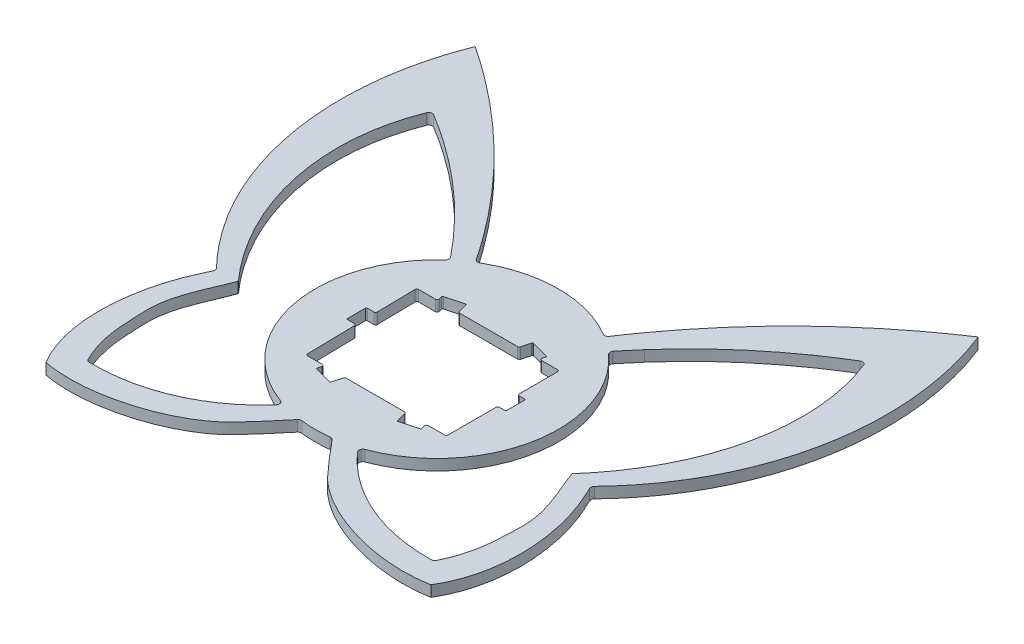
from build123d import *

# Parameters (mm, degrees)
SKETCH4_R                      = 33.5
CORE_EXTRUDE_DEPTH             = 3
LEFT_WING_EXTRUDE_DEPTH        = 3
SCREEN_CUTOUT_DEPTH            = 110.640899285
SCREEN_CUTOUT_DEPTH_BACK       = 110.640899285
LED_CUTOUT_DEPTH               = 110.640899285
LED_CUTOUT_DEPTH_BACK          = 110.640899285
WING_INTERIOR_CORNERS_FILLET_R = 1
FILLET4_R                      = 0.25
FILLET5_R                      = 0.5


with BuildPart() as part:
    # Sketch4 → Core Extrude (new body)
    with BuildSketch(Plane(origin=(0, 0, 0), x_dir=(1, 0, 0), z_dir=(0, 1, 0))):
        Circle(SKETCH4_R)
    extrude(amount=CORE_EXTRUDE_DEPTH)

    # Sketch4<3> → Left Wing Extrude (add)
    with BuildSketch(Plane(origin=(0, 0, 0), x_dir=(1, 0, 0), z_dir=(0, 1, 0))):
        with BuildLine():
            Line((-10.347153336, -31.861990174), (-10.574416, -32.223007))
            add(Edge.make_bspline(
                [(-47.69897, -48.554457), (-47.005895333, -48.581326851), (-45.954505916, -48.597017802), (-44.545738302, -48.571280153), (-43.473641766, -48.527252414), (-42.402918126, -48.458960819), (-41.334217255, -48.366466338), (-40.268122658, -48.249861876), (-39.205241478, -48.109233637), (-38.146172423, -47.944658617), (-37.091526152, -47.756231634), (-36.041906711, -47.544036079), (-34.997927299, -47.308153429), (-33.960162991, -47.048668526), (-32.929246015, -46.765677257), (-31.905878908, -46.459270641), (-30.725745207, -46.076084112), (-29.395210408, -45.600673033), (-27.922683477, -45.015601708), (-26.473441397, -44.380677994), (-25.048974531, -43.696973234), (-23.650861521, -42.965650167), (-22.28067676, -42.187857696), (-20.940013843, -41.364748569), (-19.630459024, -40.497485773), (-18.353628312, -39.58721855), (-17.111029342, -38.635148581), (-15.904502269, -37.642227441), (-14.73464199, -36.610334387), (-13.606749978, -35.537947333), (-12.508591949, -34.436177582), (-11.527977156, -33.309140575), (-10.821015407, -32.614741101), (-10.574416, -32.223007)],
                knots=[0, 0, 0, 0, 0.049532508, 0.075074575, 0.100617525, 0.126155751, 0.151690722, 0.177219143, 0.202739998, 0.228252933, 0.253755347, 0.279245241, 0.304722957, 0.330185505, 0.355633756, 0.381064261, 0.406469499, 0.444238982, 0.481947979, 0.519606395, 0.557213106, 0.594767196, 0.632267359, 0.669711427, 0.707095912, 0.744418594, 0.781676566, 0.818868141, 0.855992571, 0.893046307, 0.930030529, 0.966945445, 1, 1, 1, 1], degree=3))
            add(Edge.make_bspline(
                [(-45.941717, -8.763696), (-46.09328637, -9.192884506), (-46.42834086, -10.084854007), (-47.195678869, -11.975251266), (-48.038011165, -13.959460212), (-48.88402446, -16.027149922), (-49.507696109, -17.629829411), (-49.990853891, -18.977246269), (-50.342862874, -20.054403975), (-50.60427557, -20.91910442), (-50.852312475, -21.832776934), (-51.076720111, -22.786016913), (-51.25850344, -23.703242655), (-51.401130275, -24.590941827), (-51.508000336, -25.455502688), (-51.582538762, -26.303359745), (-51.628164435, -27.140920597), (-51.648325278, -27.974638429), (-51.6463858, -28.810813225), (-51.618990862, -29.950029305), (-51.5079164, -32.0996295), (-51.368709176, -34.256064819), (-51.253568615, -36.122660359), (-51.170401172, -36.987659949), (-51.065971706, -37.85012381), (-50.938187356, -38.709790324), (-50.78777952, -39.566142248), (-50.614740122, -40.418652335), (-50.419248729, -41.26677916), (-50.201448116, -42.109987501), (-49.961479038, -42.947751391), (-49.69949039, -43.779529588), (-49.415620595, -44.604804948), (-49.1100189, -45.423025068), (-48.782840447, -46.233685804), (-48.326357547, -47.284316489), (-47.956394456, -48.054396549), (-47.69897, -48.554457)],
                knots=[0, 0, 0, 0, 0.033014029, 0.069128858, 0.148008121, 0.189408993, 0.231211659, 0.272772284, 0.293241863, 0.313423973, 0.338306891, 0.361917513, 0.384460523, 0.406133677, 0.427134042, 0.447650525, 0.467873046, 0.487981154, 0.508148449, 0.528534245, 0.570652123, 0.664299038, 0.685324715, 0.706326456, 0.727335119, 0.748350099, 0.769374817, 0.790409684, 0.811455893, 0.83251492, 0.853587341, 0.874675049, 0.895778172, 0.916899167, 0.93803739, 0.959196012, 1, 1, 1, 1], degree=3))
            ThreePointArc((-45.941717, -8.763696), (-45.936967837, -8.705531313), (-45.961537, -8.652597))
            add(Edge.make_bspline(
                [(-59.721574, 58.433712), (-60.10521331, 57.521446141), (-60.648694561, 56.117181361), (-61.302933543, 54.205440713), (-61.762957001, 52.729756349), (-62.181955817, 51.24310242), (-62.559582347, 49.746475071), (-62.895464459, 48.241050802), (-63.2446943, 46.443308526), (-63.573812888, 44.349284385), (-63.843920225, 41.957125496), (-64.011789172, 39.557851646), (-64.079206803, 37.154376946), (-64.048019481, 34.749707714), (-63.920046805, 32.346890784), (-63.697110836, 29.948958573), (-63.381036983, 27.558934189), (-62.973651506, 25.179901505), (-62.4767372, 22.814733697), (-61.306565668, 18.114282248), (-59.705936705, 13.514753261), (-57.687269251, 9.020513919), (-56.153926642, 5.90922097), (-54.41307803, 2.815150853), (-52.506055145, -0.182345625), (-50.992041528, -2.383350968), (-48.863646775, -5.251642416), (-47.151700581, -7.316916945), (-45.961537, -8.652597)],
                knots=[0, 0, 0, 0, 0.041114028, 0.06253456, 0.083937306, 0.105324619, 0.126697311, 0.148056917, 0.16939852, 0.202773782, 0.236093287, 0.269384531, 0.302668039, 0.335958931, 0.369269967, 0.402610582, 0.435987717, 0.469405609, 0.50286597, 0.53636883, 0.670639328, 0.704295775, 0.741051276, 0.814714819, 0.851640474, 0.888628051, 0.925677779, 1, 1, 1, 1], degree=3))
            add(Edge.make_bspline(
                [(-26.322685, 30.845812), (-27.808193561, 32.533846676), (-30.101194094, 35.011732714), (-33.280566512, 38.200858525), (-35.728223071, 40.53733558), (-38.236083571, 42.815466939), (-40.679257439, 44.927032919), (-43.047215602, 46.880655758), (-45.330457493, 48.685014217), (-47.653476454, 50.44294926), (-50.01519951, 52.153685866), (-52.414546684, 53.816507436), (-55.628223758, 55.945849533), (-58.078632572, 57.463807312), (-59.721574, 58.433712)],
                knots=[0, 0, 0, 0, 0.155077445, 0.23276273, 0.310546518, 0.388428455, 0.466410335, 0.533236019, 0.600133862, 0.667102284, 0.734139577, 0.801245743, 0.86842077, 1, 1, 1, 1], degree=3))
            add(Edge.make_bspline(
                [(-22.070606, 25.765023), (-23.430544903, 27.505930683), (-24.87829729, 29.175573669), (-26.322685, 30.845812)],
                knots=[0, 0, 0, 0, 1, 1, 1, 1], degree=3))
            Line((-22.070606, 25.765023), (-21.808318715, 25.429259423))
            ThreePointArc((-21.808318715, 25.429259423), (-18.305734365, 24.898926731), (-17.767242212, 28.400265917))
            Line((-17.767242212, 28.400265917), (-18.062056, 28.803227))
            add(Edge.make_bspline(
                [(-18.062056, 28.803227), (-18.429711463, 29.305750457), (-19.106871234, 30.396056169), (-20.598244848, 32.527599994), (-21.732445935, 34.149165486), (-22.512901, 35.21333)],
                knots=[0, 0, 0, 0, 0.239345854, 0.492764217, 1, 1, 1, 1], degree=3))
            add(Edge.make_bspline(
                [(-22.512901, 35.21333), (-23.290107821, 36.281464755), (-24.474104923, 37.871090144), (-26.088286235, 39.964416697), (-27.635859882, 41.925960296), (-29.539869033, 44.263782762), (-31.824520323, 46.958210288), (-34.945454463, 50.494676889), (-38.172929781, 53.942234271), (-41.50216093, 57.295995314), (-44.051583312, 59.766281651), (-46.651008049, 62.189043303), (-50.183814542, 65.35624815), (-53.811391777, 68.423472816), (-57.528731284, 71.386741365), (-60.363232963, 73.558312111), (-63.241754367, 75.676909742), (-66.163324371, 77.741636641), (-68.138136114, 79.080969685), (-69.132374, 79.741369)],
                knots=[0, 0, 0, 0, 0.06114977, 0.09174933, 0.122365475, 0.17680904, 0.231312821, 0.285886781, 0.395140867, 0.449860298, 0.504633989, 0.559461843, 0.614343691, 0.724263139, 0.779305284, 0.834400267, 0.889547829, 0.944747787, 1, 1, 1, 1], degree=3))
            ThreePointArc((-69.132374, 79.741369), (-69.228191484, 79.754768507), (-69.298599, 79.688411))
            add(Edge.make_bspline(
                [(-69.298599, 79.688411), (-70.0156205, 77.869856855), (-70.994843213, 75.105058466), (-72.104998511, 71.358539592), (-72.838737568, 68.52445798), (-73.473459174, 65.668797314), (-74.008853496, 62.79472622), (-74.444609138, 59.905413758), (-74.780423808, 57.004024615), (-75.015980229, 54.093743038), (-75.150971994, 51.177671052), (-75.196431742, 47.286646328), (-75.039604199, 43.394444612), (-74.678636343, 39.518967018), (-74.306406035, 36.621702445), (-73.886602717, 34.074119653), (-73.335896018, 31.248934482), (-72.764439334, 28.773393853), (-72.108109938, 26.318757524), (-71.573225374, 24.487884851), (-70.610766067, 21.454537306), (-69.507587463, 18.463881405), (-68.266926826, 15.528638519), (-67.480267771, 13.782432986), (-65.82221648, 10.32104285), (-63.896168292, 6.843248155), (-61.691232235, 3.388928585), (-60.394907164, 1.479974017), (-59.04316249, -0.393960128), (-57.6371385, -2.231479423), (-56.177970697, -4.03116789), (-54.178147002, -6.360617836), (-52.610004771, -8.041077676), (-51.538644, -9.125393)],
                knots=[0, 0, 0, 0, 0.061212738, 0.091790861, 0.122342589, 0.152871804, 0.183381982, 0.213876294, 0.244357794, 0.274829395, 0.305294075, 0.335754969, 0.396669961, 0.427161537, 0.457624715, 0.488125959, 0.507998391, 0.547757237, 0.567654211, 0.587562508, 0.607482593, 0.66730875, 0.687282423, 0.707271689, 0.727277735, 0.80747111, 0.831520902, 0.855604785, 0.879720806, 0.903869538, 0.928051399, 0.952266741, 1, 1, 1, 1], degree=3))
            add(Edge.make_bspline(
                [(-53.035082, -54.550177), (-53.475981393, -53.821766706), (-54.293065635, -52.32821139), (-55.331096971, -49.994320018), (-56.186316067, -47.585308145), (-56.867148973, -45.114354512), (-57.381672993, -42.594608493), (-57.737961215, -40.039152196), (-57.944019779, -37.460903479), (-58.028851171, -34.014546734), (-57.846135041, -30.575187557), (-57.423543272, -27.18113449), (-56.996613948, -24.685918915), (-56.466157758, -22.244533993), (-55.840426798, -19.87131075), (-55.125214852, -17.578420766), (-54.20032901, -15.007785109), (-52.977130229, -12.20648687), (-52.031316344, -10.137429899), (-51.538644, -9.125393)],
                knots=[0, 0, 0, 0, 0.053947128, 0.107811694, 0.161747989, 0.215850131, 0.270157915, 0.324663059, 0.379315485, 0.434029497, 0.543119962, 0.597226917, 0.65079806, 0.703538208, 0.755555678, 0.806331737, 0.855756359, 0.928661492, 1, 1, 1, 1], degree=3))
            ThreePointArc((-53.035082, -54.550177), (-53.000788223, -54.586828142), (-52.954613, -54.606506))
            add(Edge.make_bspline(
                [(-4.780371, -33.608149), (-5.663267465, -34.535836038), (-7.30190085, -36.705350123), (-9.55855313, -39.233428864), (-11.357436947, -41.266346921), (-12.562188567, -42.582933046), (-13.464543803, -43.529564872), (-14.078811487, -44.137262958), (-14.928234547, -44.907361156), (-16.310383369, -45.989567542), (-18.300347468, -47.367877555), (-20.433980481, -48.646114968), (-22.687848194, -49.826911685), (-25.046469254, -50.90397181), (-27.492123676, -51.87338076), (-30.007682493, -52.730504113), (-32.57583771, -53.470848859), (-35.179317971, -54.08985715), (-37.800844767, -54.582961517), (-40.42315692, -54.945574058), (-43.029011249, -55.17307545), (-45.601225401, -55.260842929), (-48.918458893, -55.186196689), (-51.365749181, -54.908741303), (-52.954613, -54.606506)],
                knots=[0, 0, 0, 0, 0.069209478, 0.146521644, 0.18313548, 0.215902569, 0.242957803, 0.253802391, 0.262587851, 0.304904488, 0.348528314, 0.39334797, 0.439217763, 0.48596645, 0.533404257, 0.581328348, 0.629527656, 0.67778691, 0.725890433, 0.773626068, 0.82078889, 0.867185934, 0.912641334, 1, 1, 1, 1], degree=3))
            Line((-4.780371, -33.608149), (-4.401104144, -33.209641406))
            Line((-4.401104144, -33.209641406), (-4.722294913, -31.861990174))
            ThreePointArc((-4.722294913, -31.861990174), (-7.534724125, -30.309148248), (-10.347153336, -31.861990174))
        make_face()
    left_wing_extrude = extrude(amount=LEFT_WING_EXTRUDE_DEPTH)

    # Right Wing Mirror: Left Wing Extrude across plane
    add(left_wing_extrude.mirror(Plane(origin=(0, 0, 0), x_dir=(0, 0, 1), z_dir=(1, 0, 0))))

    # Screen Notch → Screen Cutout (cut, two sides: drawn at the far end of the back side and taken through both)
    with BuildSketch(Plane(origin=(0, 0, 0), x_dir=(1, 0, 0), z_dir=(0, 1, 0)).offset(-SCREEN_CUTOUT_DEPTH_BACK)):
        Polygon((-19.625918699, 14.112974), (-19.05613964, -17.007129), (19.637573803, -17.007129), (19.637573803, 14.112974), align=None)
    extrude(amount=SCREEN_CUTOUT_DEPTH + SCREEN_CUTOUT_DEPTH_BACK, mode=Mode.SUBTRACT)

    # Screen LED Notch → LED Cutout (cut, two sides: drawn at the far end of the back side and taken through both)
    with BuildSketch(Plane(origin=(0, 0, 0), x_dir=(1, 0, 0), z_dir=(0, 1, 0)).offset(-LED_CUTOUT_DEPTH_BACK)):
        Polygon((-19.176, 2.589), (-21.726, 2.589), (-21.976, 2.589), (-21.976, -2.861), (-21.726, -2.861), (-19.176, -2.861), (-16.176, -2.861), (-16.176, 2.589), align=None)
        Polygon((-13.741527711, -16.383005791), (-14.401516147, -18.846116683), (-9.137220319, -20.256680202), (-8.477231884, -17.79356931), (-7.700774901, -14.89579179), (-12.965070729, -13.485228272), align=None)
        Polygon((-8.347232572, 14.70921148), (-9.00722237, 17.172321319), (-14.271517319, 15.761754521), (-13.611527521, 13.298644681), (-12.835068733, 10.400867645), (-7.570773784, 11.811434444), align=None)
        Polygon((8.637894793, 14.709208286), (9.297883206, 17.172319184), (14.562179127, 15.761755691), (13.902190714, 13.298644793), (13.125733758, 10.400867266), (7.861437836, 11.811430759), align=None)
        Polygon((13.902190654, -16.383003759), (14.562179548, -18.846114528), (9.297883652, -20.256679115), (8.637894759, -17.793568346), (7.861437237, -14.89579097), (13.125733132, -13.485226383), align=None)
        Polygon((16.069, 2.589), (16.069, -2.861), (19.069, -2.861), (21.619, -2.861), (21.869, -2.861), (21.869, 2.589), (21.619, 2.589), (19.069, 2.589), align=None)
    extrude(amount=LED_CUTOUT_DEPTH + LED_CUTOUT_DEPTH_BACK, mode=Mode.SUBTRACT)

    # Wing Interior Corners Fillet
    wing_interior_corners_fillet_edges = [part.edges().sort_by_distance(p)[0] for p in [
        (10.347153336, 1.5, 31.861990174),
        (-10.347153336, 1.5, 31.861990174),
        (-17.767242212, 1.5, -28.400265917),
        (17.767242212, 1.5, -28.400265917),
        (21.808318715, 1.5, -25.429259423),
        (-21.808318715, 1.5, -25.429259423),
        (-59.721574, 1.5, -58.433712),
        (59.721574, 1.5, -58.433712),
        (51.538644, 1.5, 9.125393),
        (-47.69897, 1.5, 48.554457),
        (47.69897, 1.5, 48.554457),
        (4.401104144, 1.5, 33.209641406),
        (-4.401104144, 1.5, 33.209641406),
        (-51.538644, 1.5, 9.125393),
    ]]
    fillet(wing_interior_corners_fillet_edges, radius=WING_INTERIOR_CORNERS_FILLET_R)

    # Fillet4
    fillet4_edges = [part.edges().sort_by_distance(p)[0] for p in [
        (-9.137220319, 1.5, 20.256680202),
        (9.297883652, 1.5, 20.256679115),
        (14.562179548, 1.5, 18.846114528),
        (14.562179127, 1.5, -15.761755691),
        (9.297883206, 1.5, -17.172319184),
        (-14.271517319, 1.5, -15.761754521),
        (-9.00722237, 1.5, -17.172321319),
        (-14.401516147, 1.5, 18.846116683),
        (-21.976, 1.5, 2.861),
        (-21.976, 1.5, -2.589),
        (21.869, 1.5, 2.861),
        (21.869, 1.5, -2.589),
    ]]
    fillet(fillet4_edges, radius=FILLET4_R)

    # Fillet5
    fillet5_edges = [part.edges().sort_by_distance(p)[0] for p in [
        (-8.266505882, 1.5, 17.007129),
        (-19.05613964, 1.5, 17.007129),
        (-19.414925854, 1.5, -2.589),
        (-19.315141613, 1.5, 2.861),
        (8.427168859, 1.5, 17.007129),
        (14.069424598, 1.5, 17.007129),
        (19.637573803, 1.5, 17.007129),
        (19.637573803, 1.5, 2.861),
        (8.478134337, 1.5, -14.112974),
        (-8.187470856, 1.5, -14.112974),
        (-13.829726902, 1.5, -14.112974),
        (-19.625918699, 1.5, -14.112974),
        (19.637573803, 1.5, -14.112974),
        (19.637573803, 1.5, -2.589),
        (14.120389514, 1.5, -14.112974),
        (-13.908760986, 1.5, 17.007129),
    ]]
    fillet(fillet5_edges, radius=FILLET5_R)


solid = part.part
